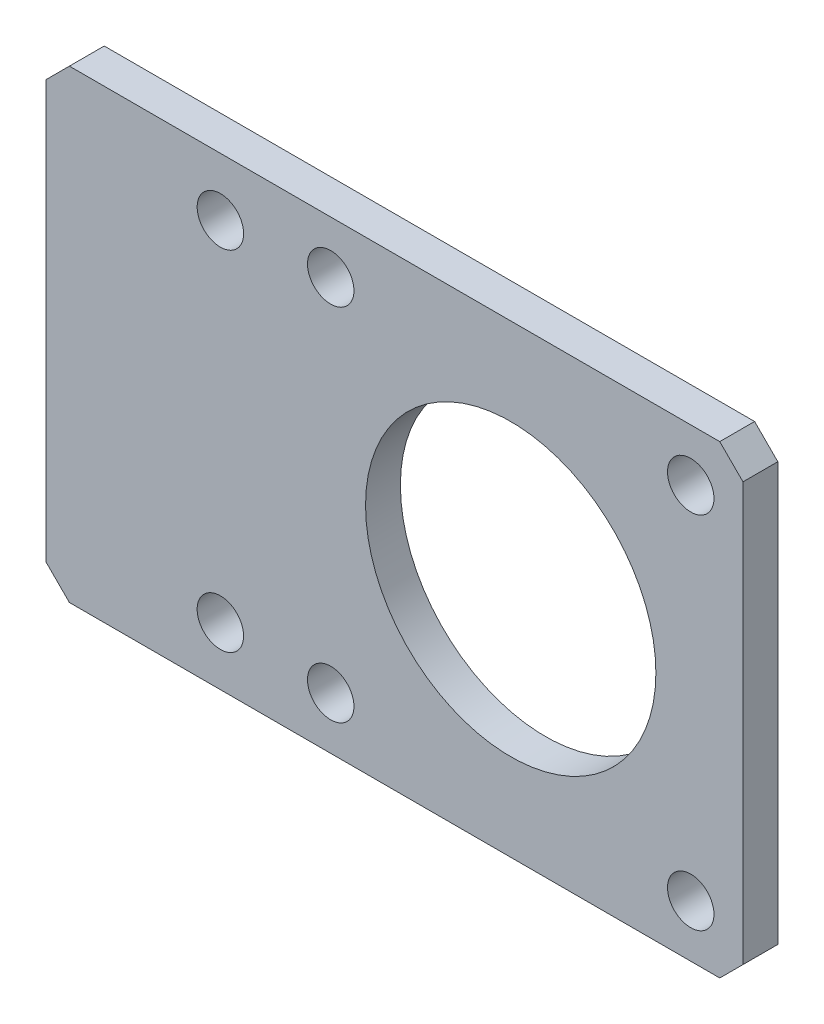
from build123d import *

# Parameters (mm, degrees)
SKETCH1_W           = 60
SKETCH1_H           = 40
BOSS_EXTRUDE1_DEPTH = 3
SKETCH2_R           = 2
SKETCH2_R_2         = 12.5
CUT_EXTRUDE1_DEPTH  = 73.173402303
CHAMFER1_SIZE       = 2


with BuildPart() as part:
    # Sketch1 → Boss-Extrude1 (new body)
    with BuildSketch(Plane.XY):
        with Locations((30, 20)):
            Rectangle(SKETCH1_W, SKETCH1_H)
    extrude(amount=BOSS_EXTRUDE1_DEPTH)

    # Sketch2 → Cut-Extrude1 (cut, through all)
    with BuildSketch(Plane.XY.offset(3)):
        with Locations((24.5, 35.5)):
            Circle(SKETCH2_R)
        with Locations((55.5, 35.5)):
            Circle(SKETCH2_R)
        with Locations((55.5, 4.5)):
            Circle(SKETCH2_R)
        with Locations((24.5, 4.5)):
            Circle(SKETCH2_R)
        with Locations((40, 20)):
            Circle(SKETCH2_R_2)
        with Locations((15, 35)):
            Circle(SKETCH2_R)
        with Locations((15, 5)):
            Circle(SKETCH2_R)
    extrude(amount=-CUT_EXTRUDE1_DEPTH, mode=Mode.SUBTRACT)

    # Chamfer1
    chamfer1_edges = [part.edges().sort_by_distance(p)[0] for p in [
        (0, 40, 1.5),
        (60, 40, 1.5),
        (60, 0, 1.5),
        (0, 0, 1.5),
    ]]
    chamfer(chamfer1_edges, length=CHAMFER1_SIZE)


solid = part.part
